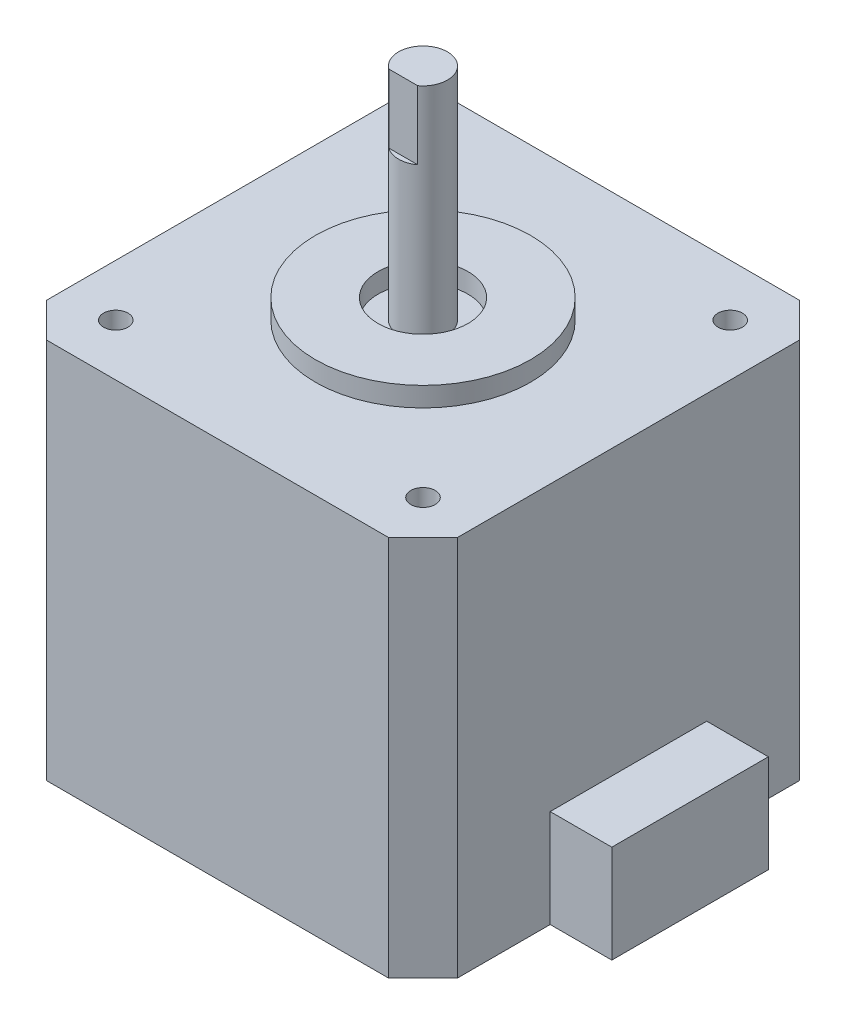
from build123d import *

# Parameters (mm, degrees)
BOSS_EXTRU_1_DEPTH      = 39
ESQUISSE2_R             = 1.25
ENL_V_MAT_EXTRU_1_DEPTH = 39
ESQUISSE3_R             = 11
ESQUISSE3_R_2           = 4.6
BOSS_EXTRU_2_DEPTH      = 2
ESQUISSE4_R             = 2.5
BOSS_EXTRU_3_DEPTH      = 22.5
ENL_V_START             = -7
ENL_V_MAT_EXTRU_4_DEPTH = 7
ESQUISSE9_W             = 16
ESQUISSE9_H             = 10
BOSS_EXTRU_4_DEPTH      = 6.3


with BuildPart() as part:
    # Esquisse1 → Boss.-Extru.1 (new body)
    with BuildSketch(Plane(origin=(0, 0, 0), x_dir=(1, 0, 0), z_dir=(0, 1, 0))):
        Polygon((3.535533906, 2.549558154), (0, 6.08509206), (0, 41.014024248), (3.535533906, 44.549558154), (38.464466094, 44.549558154), (42, 41.014024248), (42, 6.08509206), (38.464466094, 2.549558154), align=None)
    extrude(amount=BOSS_EXTRU_1_DEPTH)

    # Esquisse2 → Enlèv. mat.-Extru.1 (cut)
    with BuildSketch(Plane(origin=(0, 39, 0), x_dir=(1, 0, 0), z_dir=(0, 1, 0))):
        with Locations(Location((5.3, 39.249558154, 0), (0, 0, 270))):
            Circle(ESQUISSE2_R)
        with Locations(Location((36.7, 39.249558154, 0), (0, 0, 270))):
            Circle(ESQUISSE2_R)
        with Locations(Location((36.7, 7.849558154, 0), (0, 0, 270))):
            Circle(ESQUISSE2_R)
        with Locations(Location((5.3, 7.849558154, 0), (0, 0, 270))):
            Circle(ESQUISSE2_R)
    extrude(amount=-ENL_V_MAT_EXTRU_1_DEPTH, mode=Mode.SUBTRACT)

    # Esquisse3 → Boss.-Extru.2 (add)
    with BuildSketch(Plane(origin=(0, 39, 0), x_dir=(1, 0, 0), z_dir=(0, 1, 0))):
        with Locations(Location((21, 23.549558154, 0), (0, 0, 90))):
            Circle(ESQUISSE3_R)
        with Locations(Location((21, 23.549558154, 0), (0, 0, 270))):
            Circle(ESQUISSE3_R_2, mode=Mode.SUBTRACT)
    extrude(amount=BOSS_EXTRU_2_DEPTH)

    # Esquisse4 → Boss.-Extru.3 (add)
    with BuildSketch(Plane(origin=(0, 39, 0), x_dir=(1, 0, 0), z_dir=(0, 1, 0))):
        with Locations(Location((21, 23.549558154, 0), (0, 0, 90))):
            Circle(ESQUISSE4_R)
    extrude(amount=BOSS_EXTRU_3_DEPTH)

    # Esquisse8 → Enlèv. mat.-Extru.4 (cut)
    with BuildSketch(Plane(origin=(0, 61.5, 0), x_dir=(1, 0, 0), z_dir=(0, 1, 0)).offset(ENL_V_START)):
        with BuildLine():
            Line((22.47490916, 21.530983664), (19.52509084, 21.530983664))
            ThreePointArc((19.52509084, 21.530983664), (21, 21.049558154), (22.47490916, 21.530983664))
        make_face()
    extrude(amount=ENL_V_MAT_EXTRU_4_DEPTH, mode=Mode.SUBTRACT)

    # Esquisse9 → Boss.-Extru.4 (add)
    with BuildSketch(Plane(origin=(42, 0, 0), x_dir=(0, 0, -1), z_dir=(1, 0, 0))):
        with Locations((23.549024248, 5)):
            Rectangle(ESQUISSE9_W, ESQUISSE9_H)
    extrude(amount=BOSS_EXTRU_4_DEPTH)


solid = part.part
